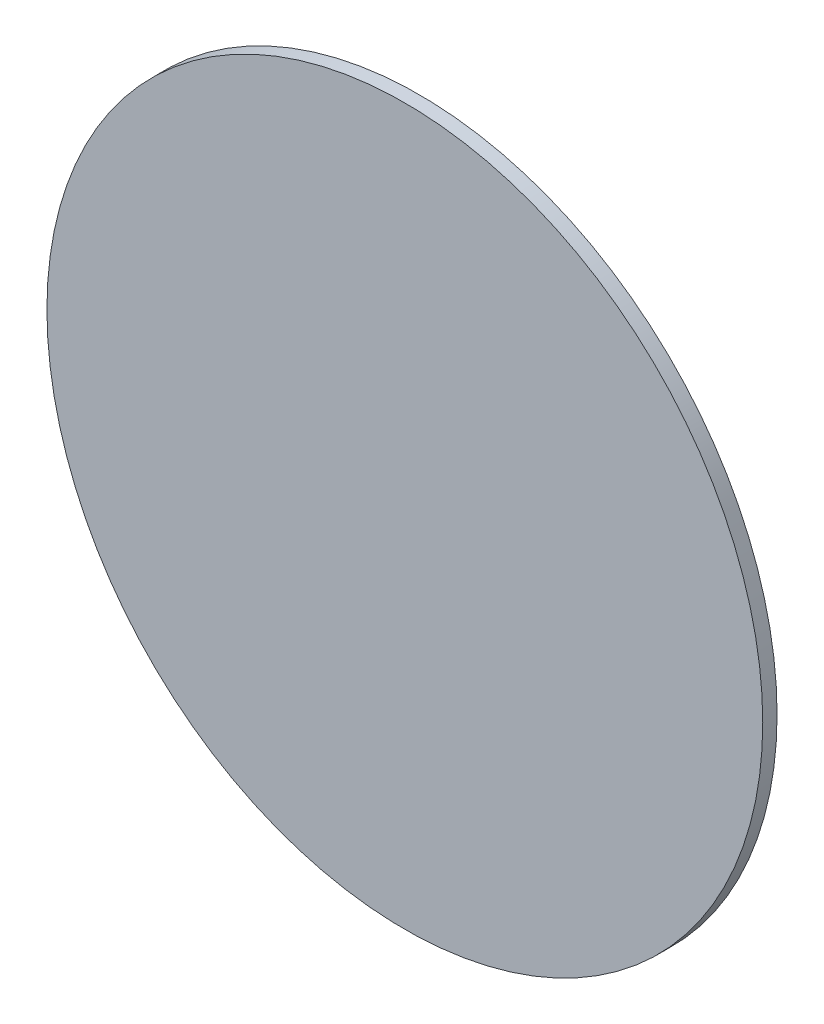
from build123d import *

# Parameters (mm, degrees)
BASEPLATE_R         = 500
BOSS_EXTRUDE1_DEPTH = 20


with BuildPart() as part:
    # Baseplate → Boss-Extrude1 (new body)
    with BuildSketch(Plane.XY):
        Circle(BASEPLATE_R)
    extrude(amount=BOSS_EXTRUDE1_DEPTH)


solid = part.part
